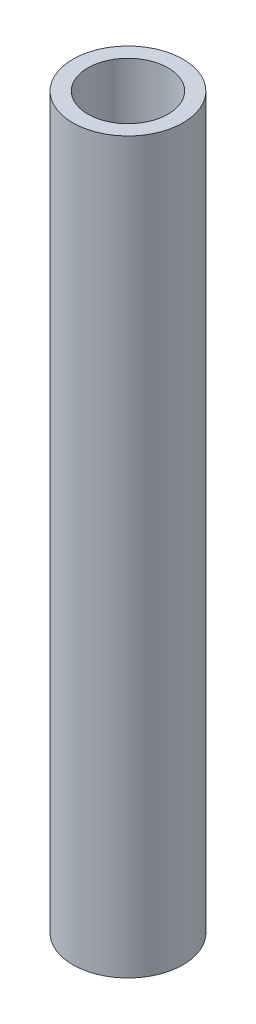
from build123d import *

# Parameters (mm, degrees)
SKETCH1_R           = 16.7005
SKETCH1_R_2         = 12.1539
BOSS_EXTRUDE1_DEPTH = 110.49


with BuildPart() as part:
    # Sketch1 → Boss-Extrude1 (new, symmetric)
    with BuildSketch(Plane(origin=(0, 0, 0), x_dir=(1, 0, 0), z_dir=(0, 1, 0))):
        with Locations(Location((0, 0, 0), (0, 0, 270))):
            Circle(SKETCH1_R)
        with Locations(Location((0, 0, 0), (0, 0, 270))):
            Circle(SKETCH1_R_2, mode=Mode.SUBTRACT)
    extrude(amount=BOSS_EXTRUDE1_DEPTH, both=True)


solid = part.part
